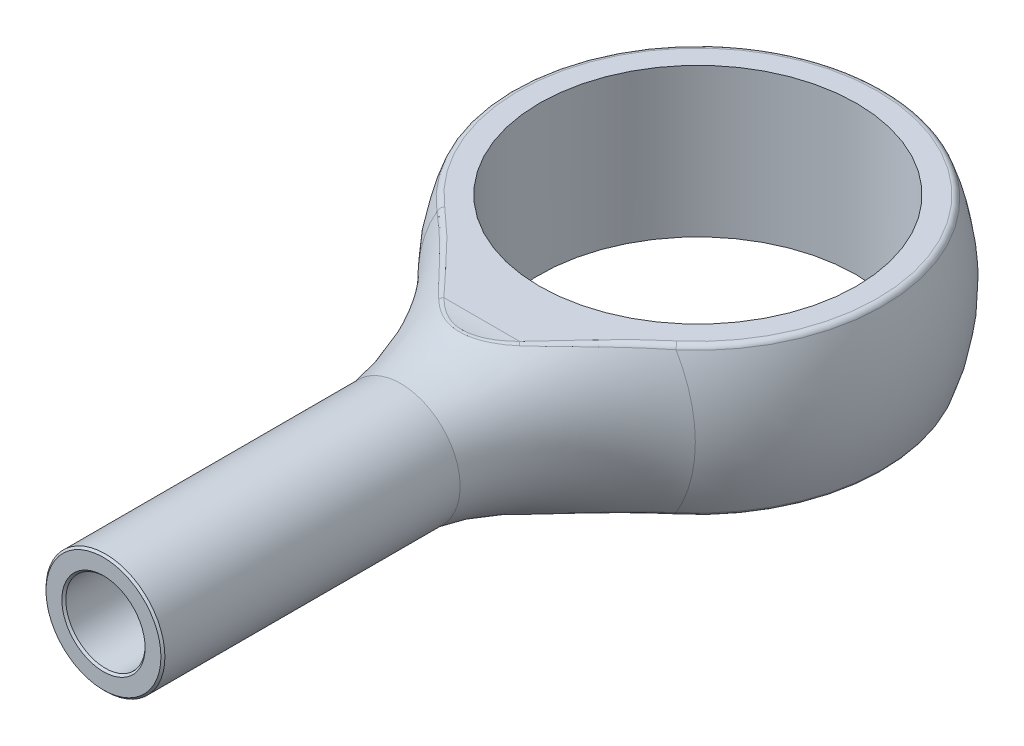
from build123d import *

# Parameters (mm, degrees)
CUT_EXTRUDE1_DEPTH      = 10
CUT_EXTRUDE1_DEPTH_BACK = 10
CUT_EXTRUDE2_DEPTH      = 10
CUT_EXTRUDE2_DEPTH_BACK = 10
SKETCH5_R               = 4
FILLET1_R               = 0.15
SKETCH6_R               = 1
CUT_EXTRUDE3_DEPTH      = 5
CHAMFER1_SIZE           = 0.05


with BuildPart() as part:
    # Sketch2 → Revolve1 (revolve)
    with BuildSketch(Plane(origin=(0, 0, 0), x_dir=(1, 0, 0), z_dir=(0, 1, 0))):
        with BuildLine():
            Line((0, -15), (-1.5, -15))
            Line((-1.5, -15), (-1.5, -7.5))
            ThreePointArc((-1.5, -7.5), (-2.180698054, -5.370520447), (-3.502942688, -3.567827424))
            ThreePointArc((-3.502942688, -3.567827424), (-4.628127976, 1.892202801), (0, 5))
            Line((0, 5), (0, -15))
        make_face()
    revolve(axis=Axis((0, 0, -5), (0, 0, 1)))

    # Sketch4 → Cut-Extrude1 (cut, two sides: drawn at the far end of the back side and taken through both)
    with BuildSketch(Plane(origin=(0, 0, 0), x_dir=(0, 0, -1), z_dir=(1, 0, 0)).offset(-CUT_EXTRUDE1_DEPTH_BACK)):
        with BuildLine():
            Line((-19.080409561, 10.311874712), (12.043742147, 10.311874712))
            Line((12.043742147, 10.311874712), (12.043742147, 1.875))
            Line((12.043742147, 1.875), (-5.454809814, 1.875))
            ThreePointArc((-5.454809814, 1.875), (-6.958338811, 2.106415246), (-8.322691996, 2.779239779))
            Line((-8.322691996, 2.779239779), (-19.080409561, 10.311874712))
        make_face()
        with BuildLine():
            Line((-8.322691996, -2.779239779), (-19.080409561, -10.311874712))
            Line((-19.080409561, -10.311874712), (12.043742147, -10.311874712))
            Line((12.043742147, -10.311874712), (12.043742147, -1.875))
            Line((12.043742147, -1.875), (-5.454809814, -1.875))
            ThreePointArc((-5.454809814, -1.875), (-6.958338811, -2.106415246), (-8.322691996, -2.779239779))
        make_face()
    extrude(amount=CUT_EXTRUDE1_DEPTH + CUT_EXTRUDE1_DEPTH_BACK, mode=Mode.SUBTRACT)

    # Sketch5 → Cut-Extrude2 (cut, two sides: drawn at the far end of the back side and taken through both)
    with BuildSketch(Plane(origin=(0, 0, 0), x_dir=(1, 0, 0), z_dir=(0, 1, 0)).offset(-CUT_EXTRUDE2_DEPTH_BACK)):
        Circle(SKETCH5_R)
    extrude(amount=CUT_EXTRUDE2_DEPTH + CUT_EXTRUDE2_DEPTH_BACK, mode=Mode.SUBTRACT)

    # Fillet1
    fillet1_edges = [part.edges().sort_by_distance(p)[0] for p in [
        (1.968342809, -1.875, 4.485095892),
        (1e-09, -1.903446851, 5.987406548),
        (-1.968342809, -1.875, 4.485095893),
        (0, -1.875, -4.635124054),
        (-1.968342809, 1.875, 4.485095892),
        (-1e-09, 1.903446851, 5.987406548),
        (1.968342809, 1.875, 4.485095893),
        (0, 1.875, -4.635124054),
    ]]
    fillet(fillet1_edges, radius=FILLET1_R)

    # Sketch6 → Cut-Extrude3 (cut)
    with BuildSketch(Plane.XY.offset(15)):
        Circle(SKETCH6_R)
    extrude(amount=-CUT_EXTRUDE3_DEPTH, mode=Mode.SUBTRACT)

    # Chamfer1
    chamfer1_edges = [part.edges().sort_by_distance(p)[0] for p in [
        (1.5, 0, 15),
        (-1, 0, 15),
    ]]
    chamfer(chamfer1_edges, length=CHAMFER1_SIZE)


solid = part.part
